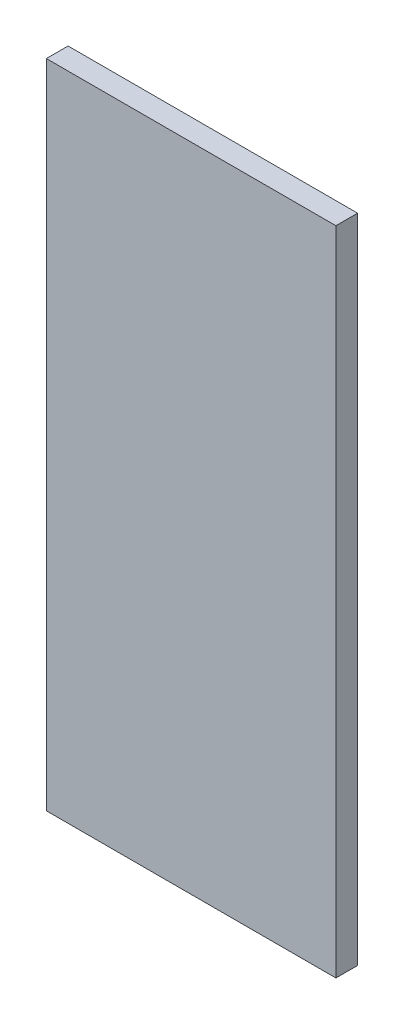
from build123d import *

# Parameters (mm, degrees)
SKETCH_1_W        = 40
SKETCH_1_H        = 90
EXTRUDE_210_DEPTH = 3


with BuildPart() as part:
    # 草图1 → Extrude 210 (new body)
    with BuildSketch(Plane.XY):
        Rectangle(SKETCH_1_W, SKETCH_1_H)
    extrude(amount=EXTRUDE_210_DEPTH)


solid = part.part
